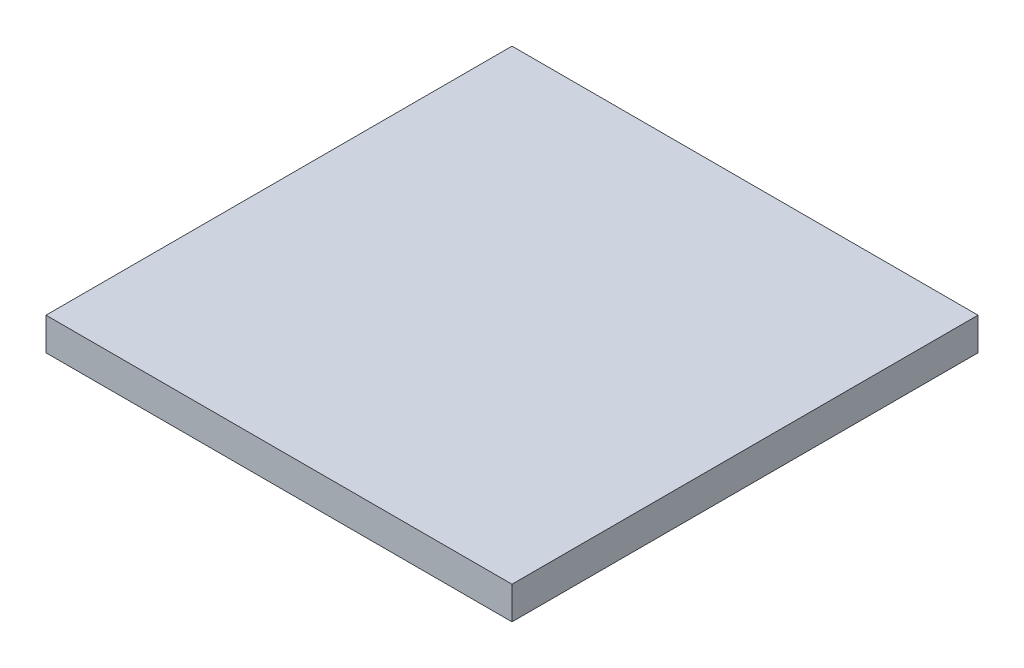
from build123d import *

# Parameters (mm, degrees)
SKETCH1_W           = 10
SKETCH1_H           = 10
BOSS_EXTRUDE1_DEPTH = 0.7


with BuildPart() as part:
    # Sketch1 → Boss-Extrude1 (new body)
    with BuildSketch(Plane(origin=(0, 0, 0), x_dir=(1, 0, 0), z_dir=(0, 1, 0))):
        Rectangle(SKETCH1_W, SKETCH1_H)
    extrude(amount=BOSS_EXTRUDE1_DEPTH)


solid = part.part
